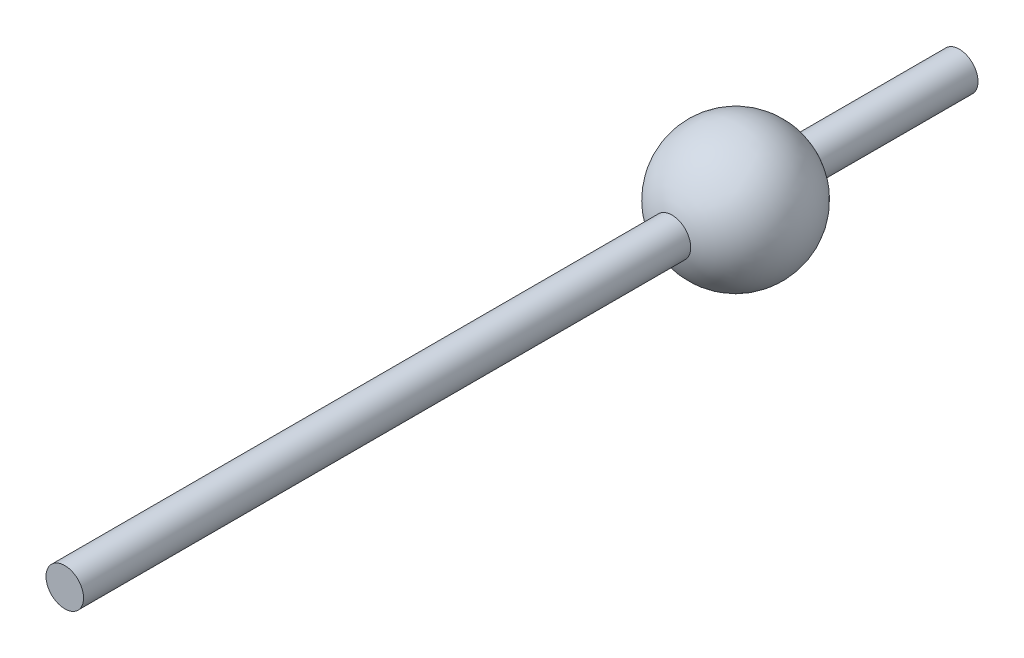
from build123d import *

# Parameters (mm, degrees)
CUT_EXTRUDE1_DEPTH      = 26.720954492
CUT_EXTRUDE1_DEPTH_BACK = 26.720954492
SKETCH2_R               = 4.2
SKETCH3_R               = 4.2
BOSS_EXTRUDE1_DEPTH     = 100
CUT_EXTRUDE2_START      = -50
SKETCH4_R               = 4.2
CUT_EXTRUDE2_DEPTH      = 50
BOSS_EXTRUDE2_START     = 50
SKETCH5_R               = 4.2
BOSS_EXTRUDE2_DEPTH     = 50


with BuildPart() as part:
    # Sketch1 → Revolve1 (revolve)
    with BuildSketch(Plane.XY):
        with BuildLine():
            Line((0, 14.85), (0, -14.85))
            ThreePointArc((0, -14.85), (14.85, 0), (0, 14.85))
        make_face()
    revolve(axis=Axis((0, 14.85, 0), (0, -1, 0)))

    # Sketch2 → Cut-Extrude1 (cut, two sides: drawn at the far end of the back side and taken through both)
    with BuildSketch(Plane.XY.offset(-CUT_EXTRUDE1_DEPTH_BACK)):
        with Locations(Location((0, 0, 0), (0, 0, 180))):
            Circle(SKETCH2_R)
    extrude(amount=CUT_EXTRUDE1_DEPTH + CUT_EXTRUDE1_DEPTH_BACK, mode=Mode.SUBTRACT)

    # Sketch3 → Boss-Extrude1 (add, symmetric)
    with BuildSketch(Plane.XY):
        Circle(SKETCH3_R)
    extrude(amount=BOSS_EXTRUDE1_DEPTH, both=True)

    # Sketch4 → Cut-Extrude2 (cut)
    with BuildSketch(Plane(origin=(0, 0, -100), x_dir=(-1, 0, 0), z_dir=(0, 0, -1)).offset(CUT_EXTRUDE2_START)):
        Circle(SKETCH4_R)
    extrude(amount=CUT_EXTRUDE2_DEPTH, mode=Mode.SUBTRACT)

    # Sketch5 → Boss-Extrude2 (add)
    with BuildSketch(Plane.XY.offset(100).offset(BOSS_EXTRUDE2_START)):
        with Locations(Location((0, 0, 0), (0, 0, 180))):
            Circle(SKETCH5_R)
    extrude(amount=-BOSS_EXTRUDE2_DEPTH)


solid = part.part
